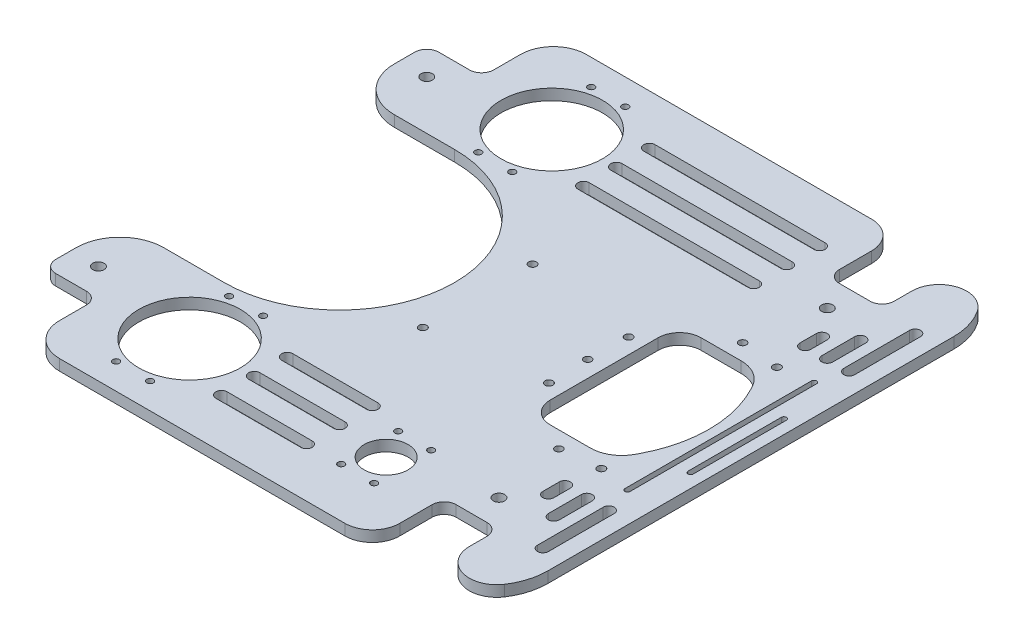
from build123d import *

# Parameters (mm, degrees)
SKETCH1_W           = 406.4
SKETCH1_H           = 304.8
BOSS_EXTRUDE1_DEPTH = 6.35
SKETCH2_R           = 29.36875
SKETCH2_R_2         = 2.2479
SKETCH2_R_3         = 1.89865
CUT_EXTRUDE1_DEPTH  = 255.079362602
SKETCH11_R          = 1.89865
SKETCH11_R_2        = 12.7
CUT_EXTRUDE7_DEPTH  = 255.079362602
FILLET1_R           = 34.925
CUT_EXTRUDE2_DEPTH  = 255.079362602
FILLET3_R           = 15.875
SKETCH7_R           = 3.2639
SKETCH7_R_2         = 2.159
CUT_EXTRUDE3_DEPTH  = 255.079362602
SKETCH8_R           = 3.2639
CUT_EXTRUDE5_DEPTH  = 255.079362602
CUT_EXTRUDE6_DEPTH  = 255.079362602
SKETCH10_W          = 44.1833
SKETCH10_H          = 6.35
BOSS_EXTRUDE2_DEPTH = 6.985
FILLET4_R           = 6.985
FILLET5_R           = 19.05
FILLET6_R           = 25.4
SKETCH12_R          = 2.2479
CUT_EXTRUDE8_DEPTH  = 255.079362602


with BuildPart() as part:
    # Sketch1 → Boss-Extrude1 (new body)
    with BuildSketch(Plane(origin=(0, 0, 0), x_dir=(1, 0, 0), z_dir=(0, 1, 0))):
        Rectangle(SKETCH1_W, SKETCH1_H)
    extrude(amount=BOSS_EXTRUDE1_DEPTH)

    # Sketch2 → Cut-Extrude1 (cut, through all)
    with BuildSketch(Plane.XZ):
        with Locations(Location((-16.8275, 104.775, 0), (0, 0, 270))):
            Circle(SKETCH2_R)
        with Locations(Location((167.428333333, -50.8, 0), (0, 0, 270))):
            Circle(SKETCH2_R_2)
        with Locations(Location((167.428333333, 50.8, 0), (0, 0, 270))):
            Circle(SKETCH2_R_2)
        with Locations(Location((45.085, -31.75, 0), (0, 0, 270))):
            Circle(SKETCH2_R_2)
        with Locations(Location((45.085, 31.75, 0), (0, 0, 270))):
            Circle(SKETCH2_R_2)
        with Locations(Location((-26.67, 137.4648, 0), (0, 0, 270))):
            Circle(SKETCH2_R_3)
        with Locations(Location((-6.985, 137.4648, 0), (0, 0, 270))):
            Circle(SKETCH2_R_3)
        with Locations(Location((-26.67, 72.0852, 0), (0, 0, 270))):
            Circle(SKETCH2_R_3)
        with Locations(Location((-6.985, 72.0852, 0), (0, 0, 270))):
            Circle(SKETCH2_R_3)
        with BuildLine():
            Line((170.786985294, 32.497058824), (169.990122549, 33.991176471))
            ThreePointArc((169.990122549, 33.991176471), (163.274429802, 41.054605225), (153.881666667, 43.65625))
            Line((153.881666667, 43.65625), (130.683, 43.65625))
            ThreePointArc((130.683, 43.65625), (121.904799642, 40.020200358), (118.26875, 31.242))
            Line((118.26875, 31.242), (118.26875, -31.242))
            ThreePointArc((118.26875, -31.242), (121.904799642, -40.020200358), (130.683, -43.65625))
            Line((130.683, -43.65625), (153.881666667, -43.65625))
            ThreePointArc((153.881666667, -43.65625), (163.274429802, -41.054605225), (169.990122549, -33.991176471))
            Line((169.990122549, -33.991176471), (170.786985294, -32.497058824))
            ThreePointArc((170.786985294, -32.497058824), (178.91125, 0), (170.786985294, 32.497058824))
        make_face()
        with BuildLine():
            Line((-73.025, 66.675), (-34.925, 66.675))
            ThreePointArc((-34.925, 66.675), (31.75, 0), (-34.925, -66.675))
            Line((-34.925, -66.675), (-73.025, -66.675))
            ThreePointArc((-73.025, -66.675), (-139.7, 0), (-73.025, 66.675))
        make_face()
    cut_extrude1 = extrude(amount=-CUT_EXTRUDE1_DEPTH, mode=Mode.SUBTRACT)

    # Sketch11 → Cut-Extrude7 (cut, through all)
    with BuildSketch(Plane(origin=(0, 6.35, 0), x_dir=(1, 0, 0), z_dir=(0, 1, 0))):
        with Locations(Location((89.916, -123.825, 0), (0, 0, 270))):
            Circle(SKETCH11_R)
        with Locations(Location((108.966, -123.825, 0), (0, 0, 270))):
            Circle(SKETCH11_R)
        with Locations(Location((99.441, -107.327216058, 0), (0, 0, 270))):
            Circle(SKETCH11_R_2)
        with Locations(Location((89.916, -90.829432116, 0), (0, 0, 270))):
            Circle(SKETCH11_R)
        with Locations(Location((108.966, -90.829432116, 0), (0, 0, 270))):
            Circle(SKETCH11_R)
    extrude(amount=-CUT_EXTRUDE7_DEPTH, mode=Mode.SUBTRACT)

    # Fillet1
    fillet1_edges = [part.edges().sort_by_distance(p)[0] for p in [
        (203.2, 3.175, 152.4),
        (-203.2, 3.175, 152.4),
        (-203.2, 3.175, -152.4),
        (203.2, 3.175, -152.4),
    ]]
    fillet(fillet1_edges, radius=FILLET1_R)

    # Sketch5 → Cut-Extrude2 (cut, through all)
    with BuildSketch(Plane(origin=(0, 6.35, 0), x_dir=(1, 0, 0), z_dir=(0, 1, 0))):
        with BuildLine():
            Line((136.525, 117.8433), (136.525, 152.4))
            Line((136.525, 152.4), (168.275, 152.4))
            Line((168.275, 152.4), (168.275, 117.8433))
            ThreePointArc((168.275, 117.8433), (166.229140867, 112.904159133), (161.29, 110.8583))
            Line((161.29, 110.8583), (143.51, 110.8583))
            ThreePointArc((143.51, 110.8583), (138.570859133, 112.904159133), (136.525, 117.8433))
        make_face()
        with BuildLine():
            Line((143.51, -110.8583), (161.29, -110.8583))
            ThreePointArc((161.29, -110.8583), (166.229140867, -112.904159133), (168.275, -117.8433))
            Line((168.275, -117.8433), (168.275, -152.4))
            Line((168.275, -152.4), (136.525, -152.4))
            Line((136.525, -152.4), (136.525, -117.8433))
            ThreePointArc((136.525, -117.8433), (138.570859133, -112.904159133), (143.51, -110.8583))
        make_face()
        with BuildLine():
            Line((-95.25, 152.4), (-63.5, 152.4))
            Line((-63.5, 152.4), (-63.5, 117.8433))
            ThreePointArc((-63.5, 117.8433), (-65.545859133, 112.904159133), (-70.485, 110.8583))
            Line((-70.485, 110.8583), (-88.265, 110.8583))
            ThreePointArc((-88.265, 110.8583), (-93.204140867, 112.904159133), (-95.25, 117.8433))
            Line((-95.25, 117.8433), (-95.25, 152.4))
        make_face()
        with BuildLine():
            Line((-88.265, -110.8583), (-70.485, -110.8583))
            ThreePointArc((-70.485, -110.8583), (-65.545859133, -112.904159133), (-63.5, -117.8433))
            Line((-63.5, -117.8433), (-63.5, -152.4))
            Line((-63.5, -152.4), (-95.25, -152.4))
            Line((-95.25, -152.4), (-95.25, -117.8433))
            ThreePointArc((-95.25, -117.8433), (-93.204140867, -112.904159133), (-88.265, -110.8583))
        make_face()
    extrude(amount=-CUT_EXTRUDE2_DEPTH, mode=Mode.SUBTRACT)

    # Fillet3
    fillet3_edges = [part.edges().sort_by_distance(p)[0] for p in [
        (168.275, 3.175, 152.4),
        (168.275, 3.175, -152.4),
        (-95.25, 3.175, -152.4),
        (-95.25, 3.175, 152.4),
        (136.525, 3.175, -152.4),
        (136.525, 3.175, 152.4),
    ]]
    fillet(fillet3_edges, radius=FILLET3_R)

    # Sketch7 → Cut-Extrude3 (cut, through all)
    with BuildSketch(Plane(origin=(0, 6.35, 0), x_dir=(1, 0, 0), z_dir=(0, 1, 0))):
        with Locations(Location((152.4, 94.9833, 0), (0, 0, 270))):
            Circle(SKETCH7_R)
        with Locations(Location((152.4, -94.9833, 0), (0, 0, 270))):
            Circle(SKETCH7_R)
        with Locations(Location((145.25625, 53.18125, 0), (0, 0, 270))):
            Circle(SKETCH7_R_2)
        with Locations(Location((108.74375, 0, 0), (0, 0, 270))):
            Circle(SKETCH7_R_2)
        with Locations(Location((145.25625, -53.18125, 0), (0, 0, 270))):
            Circle(SKETCH7_R_2)
        with BuildLine():
            Line((119.0625, 127.0889), (20.6375, 127.0889))
            ThreePointArc((20.6375, 127.0889), (17.3736, 123.825), (20.6375, 120.5611))
            Line((20.6375, 120.5611), (119.0625, 120.5611))
            ThreePointArc((119.0625, 120.5611), (122.3264, 123.825), (119.0625, 127.0889))
        make_face()
        with BuildLine():
            Line((119.0625, 88.9889), (20.6375, 88.9889))
            ThreePointArc((20.6375, 88.9889), (17.3736, 85.725), (20.6375, 82.4611))
            Line((20.6375, 82.4611), (119.0625, 82.4611))
            ThreePointArc((119.0625, 82.4611), (122.3264, 85.725), (119.0625, 88.9889))
        make_face()
        with BuildLine():
            Line((119.0625, 108.0389), (20.6375, 108.0389))
            ThreePointArc((20.6375, 108.0389), (17.3736, 104.775), (20.6375, 101.5111))
            Line((20.6375, 101.5111), (119.0625, 101.5111))
            ThreePointArc((119.0625, 101.5111), (122.3264, 104.775), (119.0625, 108.0389))
        make_face()
        with BuildLine():
            Line((193.680475862, 107.6833), (193.680475862, 69.5833))
            ThreePointArc((193.680475862, 69.5833), (190.5, 66.402824138), (187.319524138, 69.5833))
            Line((187.319524138, 69.5833), (187.319524138, 107.6833))
            ThreePointArc((187.319524138, 107.6833), (190.5, 110.863775862), (193.680475862, 107.6833))
        make_face()
        with BuildLine():
            Line((174.619524138, 69.5833), (174.619524138, 88.6333))
            ThreePointArc((174.619524138, 88.6333), (177.8, 91.813775862), (180.980475862, 88.6333))
            Line((180.980475862, 88.6333), (180.980475862, 69.5833))
            ThreePointArc((180.980475862, 69.5833), (177.8, 66.402824138), (174.619524138, 69.5833))
        make_face()
        with BuildLine():
            Line((168.280475862, 79.1083), (168.280475862, 69.5833))
            ThreePointArc((168.280475862, 69.5833), (165.1, 66.402824138), (161.919524138, 69.5833))
            Line((161.919524138, 69.5833), (161.919524138, 79.1083))
            ThreePointArc((161.919524138, 79.1083), (165.1, 82.288775862), (168.280475862, 79.1083))
        make_face()
        with BuildLine():
            Line((193.680475862, -107.6833), (193.680475862, -69.5833))
            ThreePointArc((193.680475862, -69.5833), (190.5, -66.402824138), (187.319524138, -69.5833))
            Line((187.319524138, -69.5833), (187.319524138, -107.6833))
            ThreePointArc((187.319524138, -107.6833), (190.5, -110.863775862), (193.680475862, -107.6833))
        make_face()
        with BuildLine():
            Line((174.619524138, -69.5833), (174.619524138, -88.6333))
            ThreePointArc((174.619524138, -88.6333), (177.8, -91.813775862), (180.980475862, -88.6333))
            Line((180.980475862, -88.6333), (180.980475862, -69.5833))
            ThreePointArc((180.980475862, -69.5833), (177.8, -66.402824138), (174.619524138, -69.5833))
        make_face()
        with BuildLine():
            Line((168.280475862, -79.1083), (168.280475862, -69.5833))
            ThreePointArc((168.280475862, -69.5833), (165.1, -66.402824138), (161.919524138, -69.5833))
            Line((161.919524138, -69.5833), (161.919524138, -79.1083))
            ThreePointArc((161.919524138, -79.1083), (165.1, -82.288775862), (168.280475862, -79.1083))
        make_face()
        with BuildLine():
            Line((20.6375, -82.4611), (69.85, -82.4611))
            ThreePointArc((69.85, -82.4611), (73.1139, -85.725), (69.85, -88.9889))
            Line((69.85, -88.9889), (20.6375, -88.9889))
            ThreePointArc((20.6375, -88.9889), (17.3736, -85.725), (20.6375, -82.4611))
        make_face()
        with BuildLine():
            Line((20.6375, -101.5111), (69.85, -101.5111))
            ThreePointArc((69.85, -101.5111), (73.1139, -104.775), (69.85, -108.0389))
            Line((69.85, -108.0389), (20.6375, -108.0389))
            ThreePointArc((20.6375, -108.0389), (17.3736, -104.775), (20.6375, -101.5111))
        make_face()
        with BuildLine():
            Line((20.6375, -120.5611), (69.85, -120.5611))
            ThreePointArc((69.85, -120.5611), (73.1139, -123.825), (69.85, -127.0889))
            Line((69.85, -127.0889), (20.6375, -127.0889))
            ThreePointArc((20.6375, -127.0889), (17.3736, -123.825), (20.6375, -120.5611))
        make_face()
        with BuildLine():
            Line((187.205841757, -53.975), (187.205841757, 53.975))
            ThreePointArc((187.205841757, 53.975), (185.732641757, 55.4482), (184.259441757, 53.975))
            Line((184.259441757, 53.975), (184.259441757, -53.975))
            ThreePointArc((184.259441757, -53.975), (185.732641757, -55.4482), (187.205841757, -53.975))
        make_face()
        with BuildLine():
            Line((193.784441757, 26.9875), (193.784441757, -26.9875))
            ThreePointArc((193.784441757, -26.9875), (195.257641757, -28.4607), (196.730841757, -26.9875))
            Line((196.730841757, -26.9875), (196.730841757, 26.9875))
            ThreePointArc((196.730841757, 26.9875), (195.257641757, 28.4607), (193.784441757, 26.9875))
        make_face()
    extrude(amount=-CUT_EXTRUDE3_DEPTH, mode=Mode.SUBTRACT)

    # Sketch8 → Cut-Extrude5 (cut, through all)
    with BuildSketch(Plane(origin=(0, 6.35, 0), x_dir=(1, 0, 0), z_dir=(0, 1, 0))):
        with Locations(Location((-79.375, 94.9833, 0), (0, 0, 270))):
            Circle(SKETCH8_R)
        with Locations(Location((-79.375, -94.9833, 0), (0, 0, 90))):
            Circle(SKETCH8_R)
        with BuildLine():
            Line((-95.25, 136.525), (-95.25, 117.8433))
            ThreePointArc((-95.25, 117.8433), (-93.204140867, 112.904159133), (-88.265, 110.8583))
            ThreePointArc((-88.265, 110.8583), (-110.35665, 88.76665), (-88.265, 66.675))
            Line((-88.265, 66.675), (-73.025, 66.675))
            ThreePointArc((-73.025, 66.675), (-139.7, 0), (-73.025, -66.675))
            Line((-73.025, -66.675), (-88.265, -66.675))
            ThreePointArc((-88.265, -66.675), (-110.35665, -88.76665), (-88.265, -110.8583))
            ThreePointArc((-88.265, -110.8583), (-93.204140867, -112.904159133), (-95.25, -117.8433))
            Line((-95.25, -117.8433), (-95.25, -136.525))
            ThreePointArc((-95.25, -136.525), (-99.899679849, -147.750320151), (-111.125, -152.4))
            Line((-111.125, -152.4), (-168.275, -152.4))
            ThreePointArc((-168.275, -152.4), (-192.970704333, -142.170704333), (-203.2, -117.475))
            Line((-203.2, -117.475), (-203.2, 117.475))
            ThreePointArc((-203.2, 117.475), (-192.970704333, 142.170704333), (-168.275, 152.4))
            Line((-168.275, 152.4), (-111.125, 152.4))
            ThreePointArc((-111.125, 152.4), (-99.899679849, 147.750320151), (-95.25, 136.525))
        make_face()
    extrude(amount=-CUT_EXTRUDE5_DEPTH, mode=Mode.SUBTRACT)

    # Sketch9 → Cut-Extrude6 (cut, through all)
    with BuildSketch(Plane(origin=(0, 6.35, 0), x_dir=(1, 0, 0), z_dir=(0, 1, 0))):
        with BuildLine():
            Line((-88.265, 110.8583), (-88.265, 66.675))
            ThreePointArc((-88.265, 66.675), (-110.35665, 88.76665), (-88.265, 110.8583))
        make_face()
        with BuildLine():
            Line((-88.265, -110.8583), (-88.265, -66.675))
            ThreePointArc((-88.265, -66.675), (-110.35665, -88.76665), (-88.265, -110.8583))
        make_face()
    extrude(amount=-CUT_EXTRUDE6_DEPTH, mode=Mode.SUBTRACT)

    # Sketch10 → Boss-Extrude2 (add)
    with BuildSketch(Plane.ZY.offset(88.265)):
        with Locations((-88.76665, 3.175)):
            Rectangle(SKETCH10_W, SKETCH10_H)
        with Locations((88.76665, 3.175)):
            Rectangle(SKETCH10_W, SKETCH10_H)
    extrude(amount=BOSS_EXTRUDE2_DEPTH)

    # Fillet4
    fillet4_edges = [part.edges().sort_by_distance(p)[0] for p in [
        (-95.25, 3.175, -110.8583),
        (-95.25, 3.175, 110.8583),
    ]]
    fillet(fillet4_edges, radius=FILLET4_R)

    # Mirror1: Cut-Extrude1 across plane
    add(cut_extrude1.mirror(Plane.XY), mode=Mode.SUBTRACT)

    # Fillet5
    fillet5_edges = [part.edges().sort_by_distance(p)[0] for p in [
        (-63.5, 3.175, -152.4),
        (-63.5, 3.175, 152.4),
    ]]
    fillet(fillet5_edges, radius=FILLET5_R)

    # Fillet6
    fillet6_edges = [part.edges().sort_by_distance(p)[0] for p in [
        (-95.25, 3.175, -66.675),
        (-95.25, 3.175, 66.675),
    ]]
    fillet(fillet6_edges, radius=FILLET6_R)

    # Sketch12 → Cut-Extrude8 (cut, through all)
    with BuildSketch(Plane(origin=(0, 6.35, 0), x_dir=(1, 0, 0), z_dir=(0, 1, 0))):
        with Locations(Location((109.37875, 23.0632, 0), (0, 0, 270))):
            Circle(SKETCH12_R)
        with Locations(Location((109.37875, -23.0632, 0), (0, 0, 90))):
            Circle(SKETCH12_R)
    extrude(amount=-CUT_EXTRUDE8_DEPTH, mode=Mode.SUBTRACT)


solid = part.part
